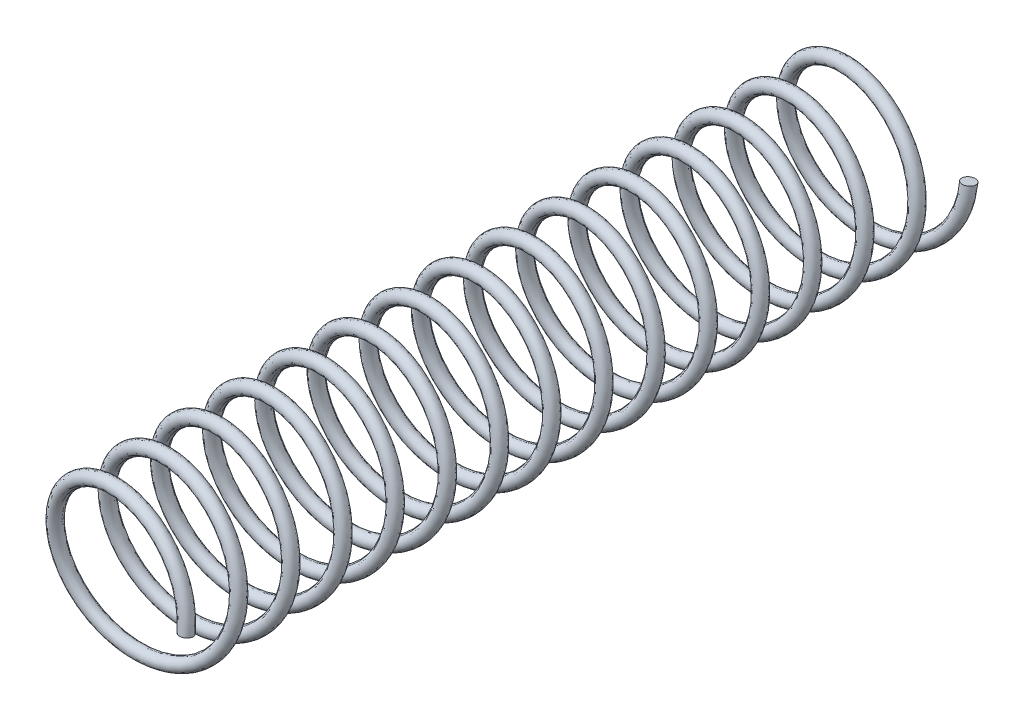
from build123d import *

# Parameters (mm, degrees)
SWEEP1_PITCH  = 2
SWEEP1_HEIGHT = 30
SWEEP1_RADIUS = 3
SKETCH3_R     = 0.25


with BuildPart() as part:
    # Sweep1: sweep along a helix
    with BuildLine() as sweep1_path:
        Helix(SWEEP1_PITCH, SWEEP1_HEIGHT, SWEEP1_RADIUS, center=(0, 0, 0), direction=(0, 0, 1), lefthand=True)
    # Sketch3 → Sweep1 (sweep)
    with BuildSketch(Plane(origin=(3, 0, 30), x_dir=(-1, 0, 0), z_dir=(-2.1551469292053908e-13, -0.9944181315116435, 0.10551104075352494))):
        Circle(SKETCH3_R)
    sweep(path=sweep1_path.line, is_frenet=True)


solid = part.part
